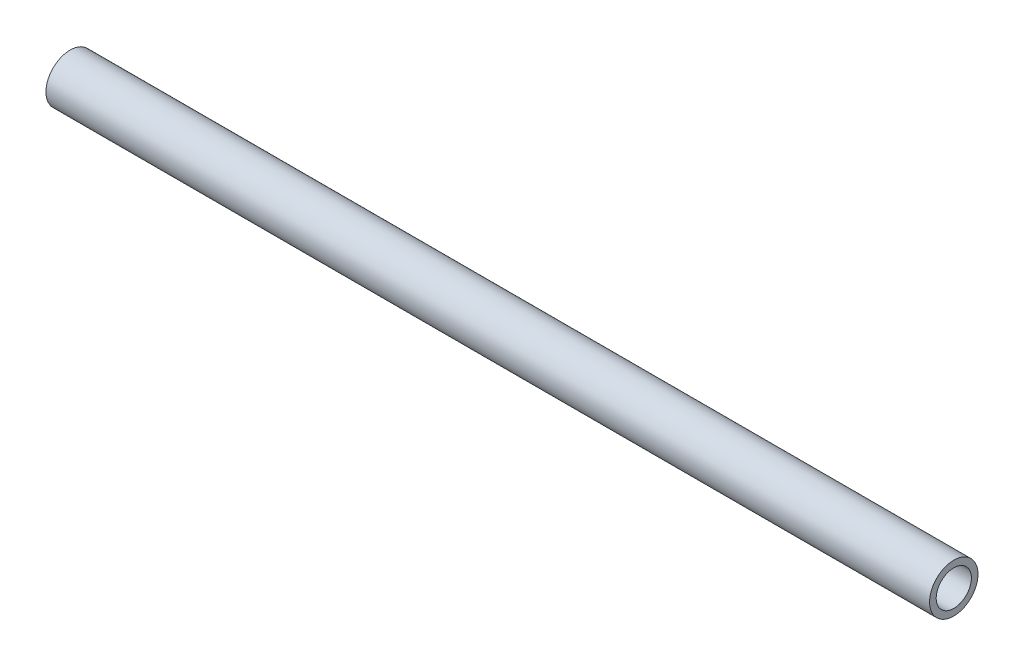
from build123d import *

# Parameters (mm, degrees)
SKETCH1_R           = 13.15
SKETCH1_R_2         = 9.55
BOSS_EXTRUDE1_DEPTH = 480


with BuildPart() as part:
    # Sketch1 → Boss-Extrude1 (new body)
    with BuildSketch(Plane(origin=(0, 0, 0), x_dir=(0, 0, -1), z_dir=(1, 0, 0))):
        Circle(SKETCH1_R)
        Circle(SKETCH1_R_2, mode=Mode.SUBTRACT)
    extrude(amount=BOSS_EXTRUDE1_DEPTH)


solid = part.part
